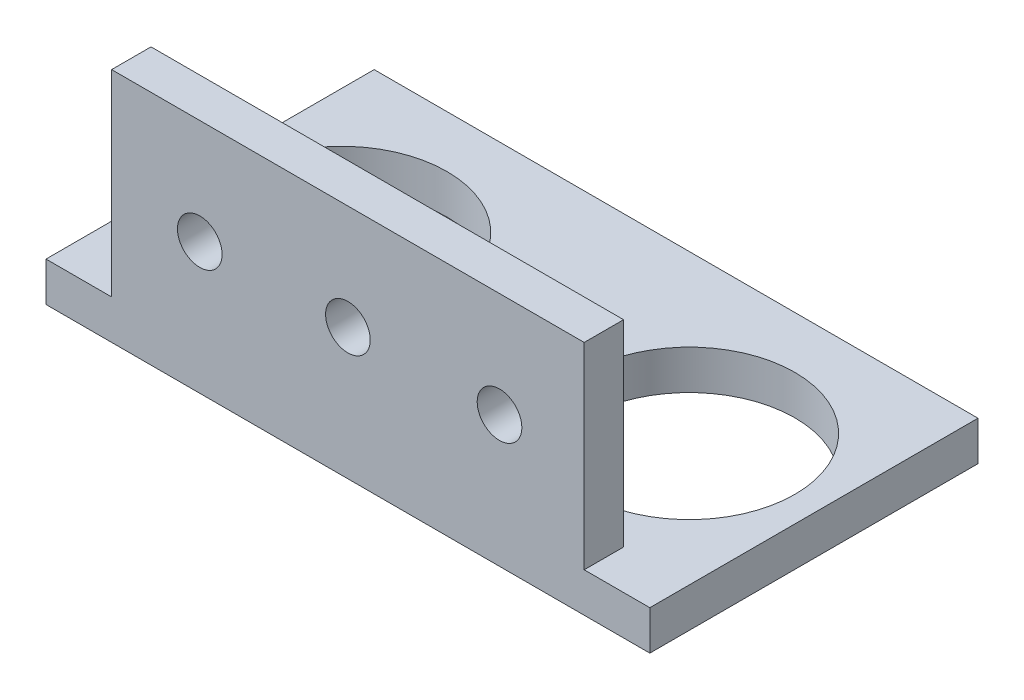
from build123d import *

# Parameters (mm, degrees)
SKIZZE1_W                            = 46
SKIZZE1_H                            = 25
AUFSATZ_LINEAR_AUSTRAGEN1_DEPTH      = 3
SKIZZE3_W                            = 46
SKIZZE3_H                            = 3
AUFSATZ_LINEAR_AUSTRAGEN2_DEPTH      = 15
SCHNITT_LINEAR_AUSTRAGEN1_REACH      = 38.565
SKIZZE7_W                            = 5
SKIZZE7_H                            = 15
F_3_4_3_4_DIAMETER_HOLE2_D           = 3.4
F_3_4_3_4_DIAMETER_HOLE2_CSINK_D     = 3.45
F_3_4_3_4_DIAMETER_HOLE2_CSINK_ANGLE = 90
SCHNITT_LINEAR_AUSTRAGEN2_REACH      = 33.769
SKIZZE12_R                           = 8.05
SKIZZE12_W                           = 12
SKIZZE12_H                           = 4


with BuildPart() as part:
    # Skizze1 → Aufsatz-Linear austragen1 (new body)
    with BuildSketch(Plane(origin=(0, 0, 0), x_dir=(1, 0, 0), z_dir=(0, 1, 0))):
        Rectangle(SKIZZE1_W, SKIZZE1_H)
    extrude(amount=AUFSATZ_LINEAR_AUSTRAGEN1_DEPTH)

    # Skizze3 → Aufsatz-Linear austragen2 (add)
    with BuildSketch(Plane(origin=(0, 3, 0), x_dir=(1, 0, 0), z_dir=(0, 1, 0))):
        with Locations((0, -11)):
            Rectangle(SKIZZE3_W, SKIZZE3_H)
    extrude(amount=AUFSATZ_LINEAR_AUSTRAGEN2_DEPTH)

    # Skizze7 → Schnitt-Linear austragen1 (cut, up to next)
    with BuildSketch(Plane(origin=(0, 0, 9.5), x_dir=(-1, 0, 0), z_dir=(0, 0, -1)), mode=Mode.PRIVATE) as schnitt_linear_austragen1_sk1:
        with Locations((-20.5, 10.5)):
            Rectangle(SKIZZE7_W, SKIZZE7_H)
    schnitt_linear_austragen1_tool1 = extrude(schnitt_linear_austragen1_sk1.sketch, amount=-SCHNITT_LINEAR_AUSTRAGEN1_REACH, mode=Mode.PRIVATE) & part.part
    # Skizze7 → Schnitt-Linear austragen1 (cut, up to next)
    with BuildSketch(Plane(origin=(0, 0, 9.5), x_dir=(-1, 0, 0), z_dir=(0, 0, -1)), mode=Mode.PRIVATE) as schnitt_linear_austragen1_sk2:
        with Locations((20.5, 10.5)):
            Rectangle(SKIZZE7_W, SKIZZE7_H)
    schnitt_linear_austragen1_tool2 = extrude(schnitt_linear_austragen1_sk2.sketch, amount=-SCHNITT_LINEAR_AUSTRAGEN1_REACH, mode=Mode.PRIVATE) & part.part
    add(schnitt_linear_austragen1_tool1.solids().sort_by_distance((20.5, 10.5, 9.5))[0], mode=Mode.SUBTRACT)
    add(schnitt_linear_austragen1_tool2.solids().sort_by_distance((-20.5, 10.5, 9.5))[0], mode=Mode.SUBTRACT)

    # Ø3.4 (3.4) Diameter Hole2 (through all)
    with Locations(Plane(origin=(0, 0, 9.5), x_dir=(-1, 0, 0), z_dir=(0, 0, -1))):
        with Locations((-11.547540619, 10.006035736), (0, 10.006035736), (11.285096514, 10.006035736)):
            CounterSinkHole(F_3_4_3_4_DIAMETER_HOLE2_D / 2, F_3_4_3_4_DIAMETER_HOLE2_CSINK_D / 2, counter_sink_angle=F_3_4_3_4_DIAMETER_HOLE2_CSINK_ANGLE)

    # Skizze12 → Schnitt-Linear austragen2 (cut, up to next)
    with BuildSketch(Plane.XZ, mode=Mode.PRIVATE) as schnitt_linear_austragen2_sk1:
        with Locations(Location((-13.5, -0.5, 0), (0, 0, 270))):
            Circle(SKIZZE12_R)
    schnitt_linear_austragen2_tool1 = extrude(schnitt_linear_austragen2_sk1.sketch, amount=-SCHNITT_LINEAR_AUSTRAGEN2_REACH, mode=Mode.PRIVATE) & part.part
    # Skizze12 → Schnitt-Linear austragen2 (cut, up to next)
    with BuildSketch(Plane.XZ, mode=Mode.PRIVATE) as schnitt_linear_austragen2_sk2:
        with Locations(Location((13, -0.5, 0), (0, 0, 270))):
            Circle(SKIZZE12_R)
    schnitt_linear_austragen2_tool2 = extrude(schnitt_linear_austragen2_sk2.sketch, amount=-SCHNITT_LINEAR_AUSTRAGEN2_REACH, mode=Mode.PRIVATE) & part.part
    # Skizze12 → Schnitt-Linear austragen2 (cut, up to next)
    with BuildSketch(Plane.XZ, mode=Mode.PRIVATE) as schnitt_linear_austragen2_sk3:
        with Locations((-0.5, 7.3)):
            Rectangle(SKIZZE12_W, SKIZZE12_H)
    schnitt_linear_austragen2_tool3 = extrude(schnitt_linear_austragen2_sk3.sketch, amount=-SCHNITT_LINEAR_AUSTRAGEN2_REACH, mode=Mode.PRIVATE) & part.part
    add(schnitt_linear_austragen2_tool1.solids().sort_by_distance((-13.5, 0, -0.5))[0], mode=Mode.SUBTRACT)
    add(schnitt_linear_austragen2_tool2.solids().sort_by_distance((13, 0, -0.5))[0], mode=Mode.SUBTRACT)
    add(schnitt_linear_austragen2_tool3.solids().sort_by_distance((-0.5, 0, 7.3))[0], mode=Mode.SUBTRACT)


solid = part.part
